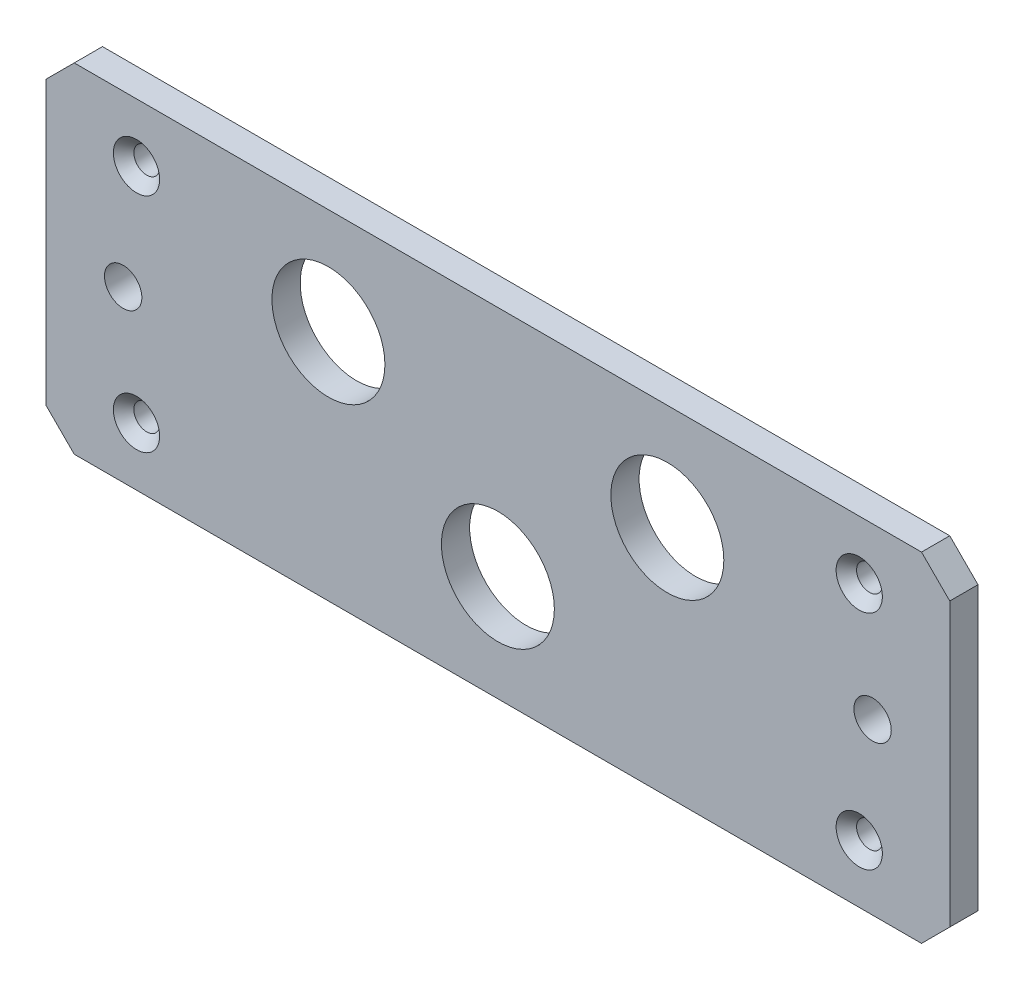
from build123d import *

# Parameters (mm, degrees)
SKETCH1_W                                       = 203.2
SKETCH1_H                                       = 76.2
BOSS_EXTRUDE1_DEPTH                             = 6.35
M8_CLEARANCE_HOLE1_D                            = 8.4
M8_CLEARANCE_HOLE1_DEPTH                        = 10.668
M8_CLEARANCE_HOLE1_TIP                          = 2.5236146
CHAMFER1_SIZE                                   = 6.35
CSK_FOR_M5_FLAT_HEAD_MACHINE_SCREW1_D           = 5.8
CSK_FOR_M5_FLAT_HEAD_MACHINE_SCREW1_CSINK_D     = 10.4
CSK_FOR_M5_FLAT_HEAD_MACHINE_SCREW1_CSINK_ANGLE = 90
F_1_1_DIAMETER_HOLE1_D                          = 25.4


with BuildPart() as part:
    # Sketch1 → Boss-Extrude1 (new body)
    with BuildSketch(Plane.XY):
        Rectangle(SKETCH1_W, SKETCH1_H)
    extrude(amount=BOSS_EXTRUDE1_DEPTH)

    # M8 Clearance Hole1
    with Locations(Plane.XY.offset(6.35)):
        with Locations((84.25, 0), (-84.25, 0)):
            Hole(M8_CLEARANCE_HOLE1_D / 2, depth=M8_CLEARANCE_HOLE1_DEPTH)
            with Locations((0, 0, -(M8_CLEARANCE_HOLE1_DEPTH + M8_CLEARANCE_HOLE1_TIP / 2))):  # 118° drill point
                Cone(0, M8_CLEARANCE_HOLE1_D / 2, M8_CLEARANCE_HOLE1_TIP, mode=Mode.SUBTRACT)

    # Chamfer1
    chamfer1_edges = [part.edges().sort_by_distance(p)[0] for p in [
        (-101.6, 38.1, 3.175),
        (101.6, 38.1, 3.175),
        (101.6, -38.1, 3.175),
        (-101.6, -38.1, 3.175),
    ]]
    chamfer(chamfer1_edges, length=CHAMFER1_SIZE)

    # CSK for M5 Flat Head Machine Screw1 (through all)
    with Locations(Plane.XY.offset(6.35)):
        with Locations((81.25, 25), (81.25, -25), (-81.25, -25), (-81.25, 25)):
            CounterSinkHole(CSK_FOR_M5_FLAT_HEAD_MACHINE_SCREW1_D / 2, CSK_FOR_M5_FLAT_HEAD_MACHINE_SCREW1_CSINK_D / 2, counter_sink_angle=CSK_FOR_M5_FLAT_HEAD_MACHINE_SCREW1_CSINK_ANGLE)

    # 1 (1) Diameter Hole1 (through all)
    with Locations(Plane.XY.offset(6.35)):
        with Locations((0, -14.2875), (-38.1, 14.2875), (38.1, 14.2875)):
            Hole(F_1_1_DIAMETER_HOLE1_D / 2)


solid = part.part
